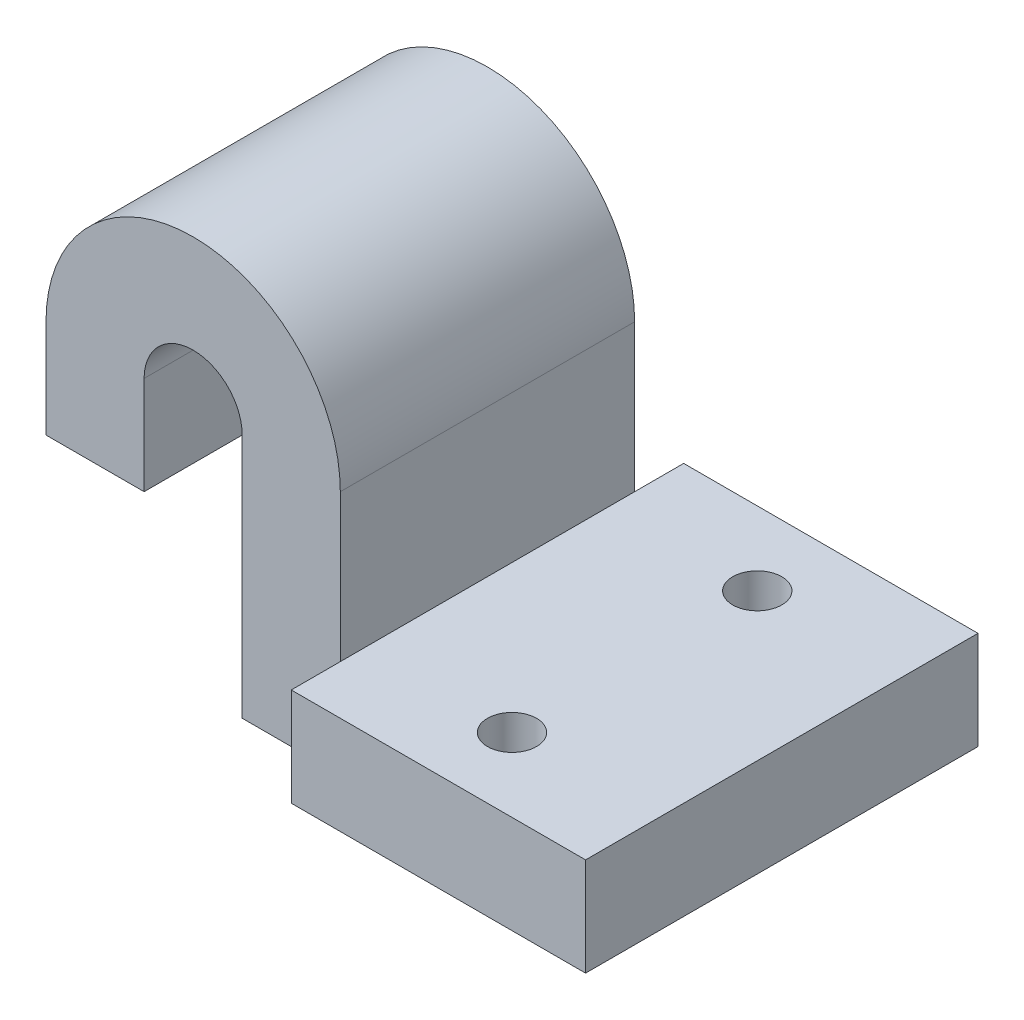
from build123d import *

# Parameters (mm, degrees)
SKETCH1_W           = 38.1
SKETCH1_H           = 19.05
SKETCH1_R           = 3.175
SKETCH1_H_2         = 12.7
BOSS_EXTRUDE2_DEPTH = 12.7
SKETCH3_W           = 12.7
SKETCH3_H           = 31.75
SKETCH3_H_2         = 12.7
BOSS_EXTRUDE3_DEPTH = 38.1


with BuildPart() as part:
    # Sketch1 → Boss-Extrude2 (new body)
    # profile 1 of 3: a face of its own
    with BuildSketch(Plane(origin=(0, 0, 0), x_dir=(1, 0, 0), z_dir=(0, 1, 0))):
        Rectangle(SKETCH1_W, SKETCH1_H)
        with Locations(Location((0, 0, 0), (0, 0, 270))):
            Circle(SKETCH1_R, mode=Mode.SUBTRACT)
    # profile 2 of 3: a face of its own
    with BuildSketch(Plane(origin=(0, 0, 0), x_dir=(1, 0, 0), z_dir=(0, 1, 0))):
        with Locations((0, -15.875)):
            Rectangle(SKETCH1_W, SKETCH1_H_2)
    # profile 3 of 3: a face of its own
    with BuildSketch(Plane(origin=(0, 0, 0), x_dir=(1, 0, 0), z_dir=(0, 1, 0))):
        with Locations((0, -31.75)):
            Rectangle(SKETCH1_W, SKETCH1_H)
        with Locations(Location((0, -31.75, 0), (0, 0, 270))):
            Circle(SKETCH1_R, mode=Mode.SUBTRACT)
    extrude(amount=BOSS_EXTRUDE2_DEPTH)

    # Sketch3 → Boss-Extrude3 (add)
    with BuildSketch(Plane.XY.offset(34.925)):
        with BuildLine():
            ThreePointArc((-31.75, 31.75), (-38.1, 38.1), (-44.45, 31.75))
            Line((-44.45, 31.75), (-57.15, 31.75))
            ThreePointArc((-57.15, 31.75), (-38.1, 50.8), (-19.05, 31.75))
            Line((-19.05, 31.75), (-31.75, 31.75))
        make_face()
        with Locations((-25.4, 15.875)):
            Rectangle(SKETCH3_W, SKETCH3_H)
        with Locations((-50.8, 25.4)):
            Rectangle(SKETCH3_W, SKETCH3_H_2)
    extrude(amount=-BOSS_EXTRUDE3_DEPTH)


solid = part.part
